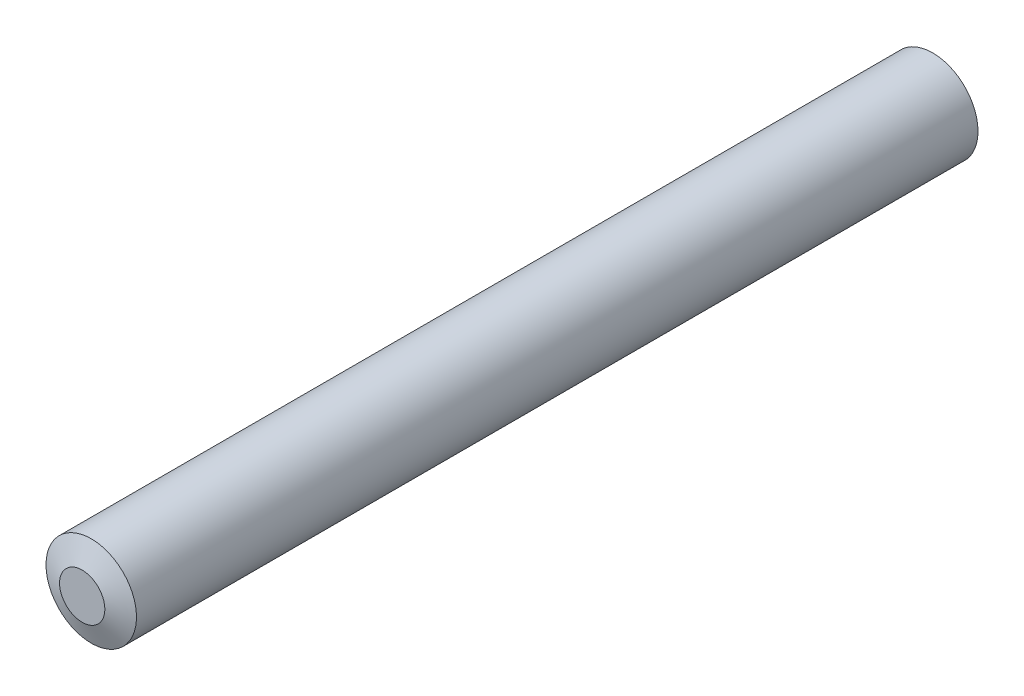
from build123d import *

# Parameters (mm, degrees)
SKETCH_1_R      = 2
EXTRUDE_1_DEPTH = 38
CHAMFER_1_SIZE  = 0.4
CHAMFER_1_SIZE2 = 1
CHAMFER_2_SIZE  = 1
CHAMFER_2_SIZE2 = 0.4


with BuildPart() as part:
    # 草图1 → 拉伸1 (new body)
    with BuildSketch(Plane.XY):
        Circle(SKETCH_1_R)
    extrude(amount=EXTRUDE_1_DEPTH)

    # 倒角1
    chamfer_1_edges = [part.edges().sort_by_distance(p)[0] for p in [
        (-2, 0, 38),
    ]]
    chamfer_1_side = [part.faces().sort_by_distance(p)[0] for p in [
        (-2, 0, 19),
    ]]
    chamfer(chamfer_1_edges, length=CHAMFER_1_SIZE, length2=CHAMFER_1_SIZE2, reference=chamfer_1_side[0])

    # 倒角2
    chamfer_2_edges = [part.edges().sort_by_distance(p)[0] for p in [
        (-2, 0, 0),
    ]]
    chamfer_2_side = [part.faces().sort_by_distance(p)[0] for p in [
        (0, 0, 0),
    ]]
    chamfer(chamfer_2_edges, length=CHAMFER_2_SIZE, length2=CHAMFER_2_SIZE2, reference=chamfer_2_side[0])


solid = part.part
